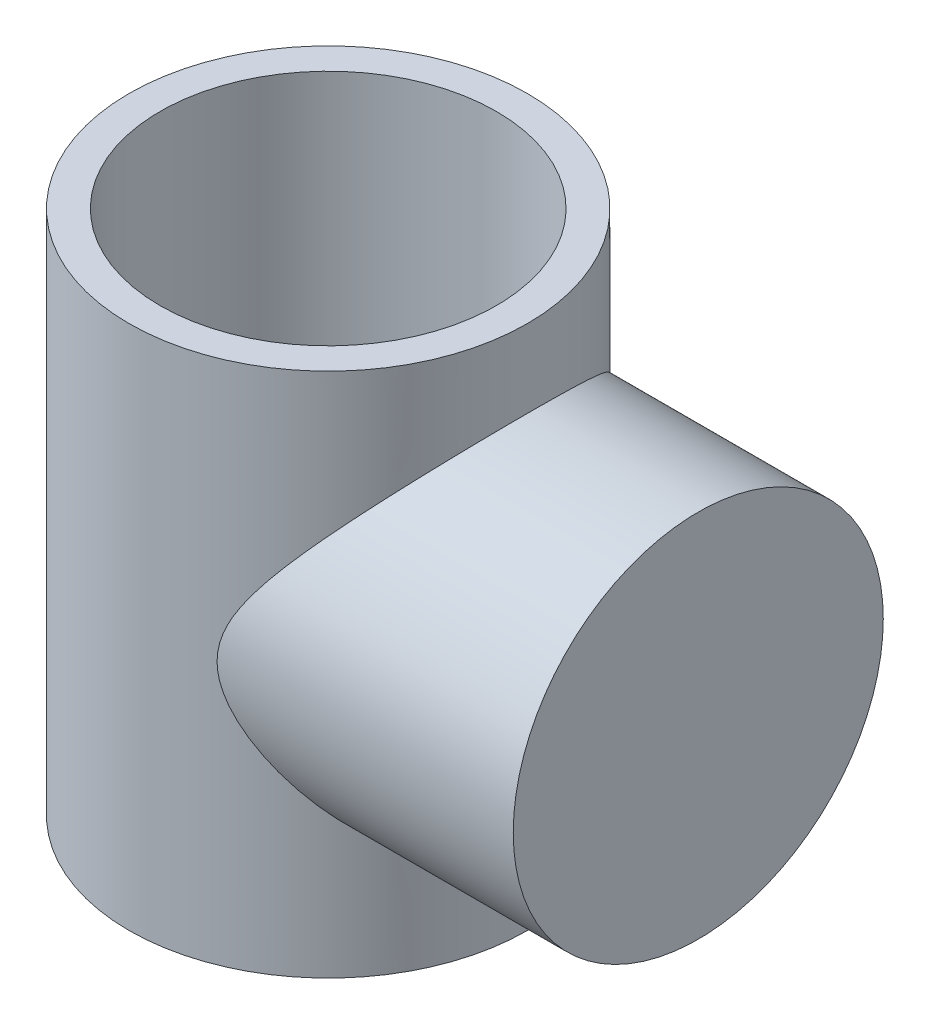
from build123d import *

# Parameters (mm, degrees)
SKETCH1_R               = 4.4
BOSS_EXTRUDE1_DEPTH     = 8.8
SKETCH2_R               = 4.737731287
SKETCH2_R_2             = 4
BOSS_EXTRUDE2_DEPTH     = 6.25
CUT_EXTRUDE1_DEPTH      = 12.787646148
CUT_EXTRUDE1_DEPTH_BACK = 12.787646148
SKETCH3_R               = 4


with BuildPart() as part:
    # Sketch1 → Boss-Extrude1 (new body)
    with BuildSketch(Plane.YZ):
        with Locations(Location((0, 0, 0), (0, 0, 270))):
            Circle(SKETCH1_R)
    extrude(amount=BOSS_EXTRUDE1_DEPTH)

    # Sketch2 → Boss-Extrude2 (add, symmetric)
    with BuildSketch(Plane(origin=(0, 0, 0), x_dir=(-1, 0, 0), z_dir=(0, 1, 0))):
        with Locations(Location((0, 0, 0), (0, 0, 90))):
            Circle(SKETCH2_R)
        with Locations(Location((0, 0, 0), (0, 0, 90))):
            Circle(SKETCH2_R_2, mode=Mode.SUBTRACT)
    extrude(amount=BOSS_EXTRUDE2_DEPTH, both=True)

    # Sketch3 → Cut-Extrude1 (cut, two sides: drawn at the far end of the back side and taken through both)
    with BuildSketch(Plane(origin=(0, 0, 0), x_dir=(-1, 0, 0), z_dir=(0, 1, 0)).offset(-CUT_EXTRUDE1_DEPTH_BACK)):
        with Locations(Location((0, 0, 0), (0, 0, 90))):
            Circle(SKETCH3_R)
    extrude(amount=CUT_EXTRUDE1_DEPTH + CUT_EXTRUDE1_DEPTH_BACK, mode=Mode.SUBTRACT)


solid = part.part
